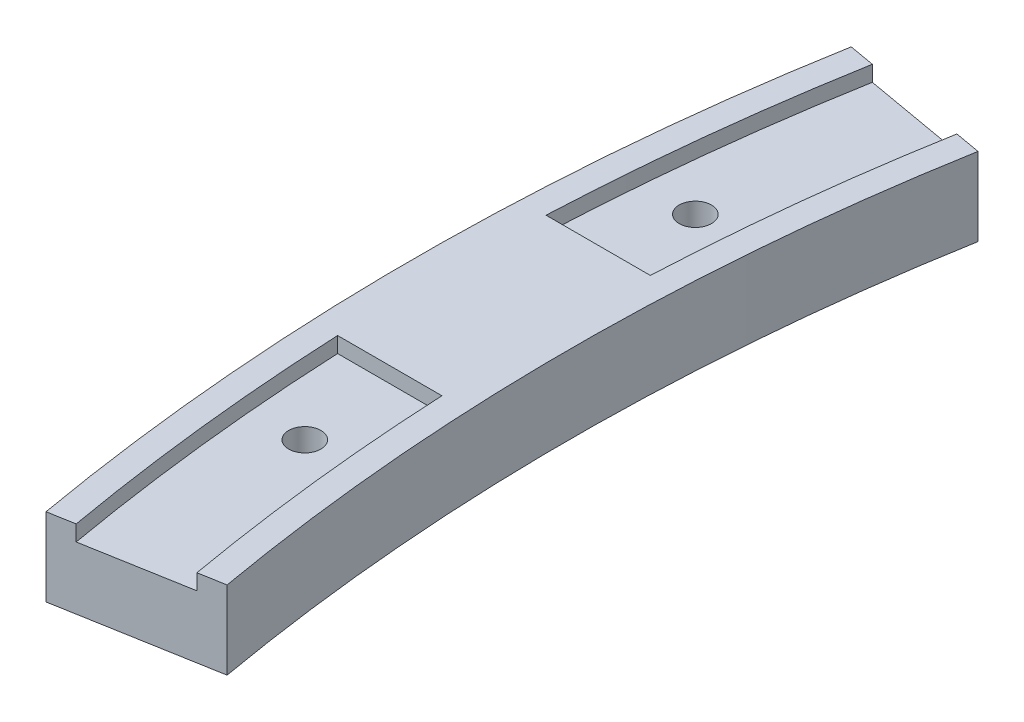
from build123d import *

# Parameters (mm, degrees)
BOSS_EXTRUDE1_DEPTH        = 7.5
CUT_EXTRUDE1_DEPTH         = 1.5
F_3_1_3_1_DIAMETER_HOLE1_D = 3.1


with BuildPart() as part:
    # Sketch1 → Boss-Extrude1 (new body)
    with BuildSketch(Plane(origin=(0, 0, 0), x_dir=(1, 0, 0), z_dir=(0, 1, 0))):
        with BuildLine():
            Line((-219.119725045, 38.636719531), (-204.34760875, 36.031996866))
            ThreePointArc((-204.34760875, 36.031996866), (-207.5, 0), (-204.34760875, -36.031996866))
            Line((-204.34760875, -36.031996866), (-219.119725045, -38.636719531))
            ThreePointArc((-219.119725045, -38.636719531), (-222.5, 0), (-219.119725045, 38.636719531))
        make_face()
    extrude(amount=BOSS_EXTRUDE1_DEPTH)

    # Sketch2 → Cut-Extrude1 (cut)
    with BuildSketch(Plane(origin=(0, 7.5, 0), x_dir=(1, 0, 0), z_dir=(0, 1, 0))):
        with BuildLine():
            Line((-206.809628133, 36.46611731), (-216.657705663, 38.202599087))
            ThreePointArc((-216.657705663, 38.202599087), (-218.670303662, 24.151569236), (-219.772609758, 10))
            Line((-219.772609758, 10), (-209.761769634, 10))
            ThreePointArc((-209.761769634, 10), (-208.70564487, 23.279901188), (-206.809628133, 36.46611731))
        make_face()
        with BuildLine():
            Line((-209.761769634, -10), (-219.772609758, -10))
            ThreePointArc((-219.772609758, -10), (-218.670303662, -24.151569236), (-216.657705663, -38.202599087))
            Line((-216.657705663, -38.202599087), (-206.809628133, -36.46611731))
            ThreePointArc((-206.809628133, -36.46611731), (-208.70564487, -23.279901188), (-209.761769634, -10))
        make_face()
    extrude(amount=-CUT_EXTRUDE1_DEPTH, mode=Mode.SUBTRACT)

    # Ø3.1 (3.1) Diameter Hole1 (through all)
    with Locations(Plane(origin=(0, 0, 0), x_dir=(-1, 0, 0), z_dir=(0, -1, 0))):
        with Locations((214.18186009, -18.738484691), (214.18186009, 18.738484691)):
            Hole(F_3_1_3_1_DIAMETER_HOLE1_D / 2)


solid = part.part
